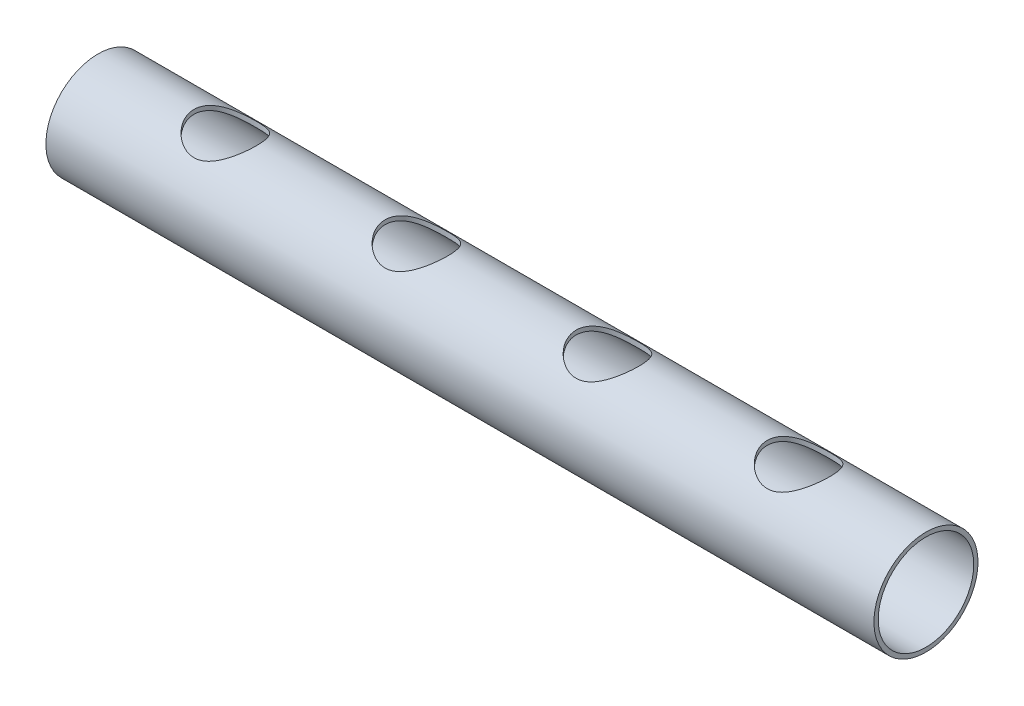
from build123d import *

# Parameters (mm, degrees)
SKETCH1_R           = 41.5
SKETCH1_R_2         = 38.1
BOSS_EXTRUDE1_DEPTH = 660.4
SKETCH2_R           = 25
CUT_EXTRUDE1_DEPTH  = 664.002760175


with BuildPart() as part:
    # Sketch1 → Boss-Extrude1 (new body)
    with BuildSketch(Plane(origin=(0, 0, 0), x_dir=(0, 0, -1), z_dir=(1, 0, 0))):
        Circle(SKETCH1_R)
        Circle(SKETCH1_R_2, mode=Mode.SUBTRACT)
    extrude(amount=BOSS_EXTRUDE1_DEPTH)

    # Sketch2 → Cut-Extrude1 (cut, through all)
    with BuildSketch(Plane(origin=(0, 0, 0), x_dir=(1, 0, 0), z_dir=(0, 1, 0))):
        with Locations(Location((101.6, 0, 0), (0, 0, 90))):
            Circle(SKETCH2_R)
        with Locations(Location((254, 0, 0), (0, 0, 90))):
            Circle(SKETCH2_R)
        with Locations(Location((406.4, 0, 0), (0, 0, 90))):
            Circle(SKETCH2_R)
        with Locations(Location((558.8, 0, 0), (0, 0, 90))):
            Circle(SKETCH2_R)
    extrude(amount=CUT_EXTRUDE1_DEPTH, mode=Mode.SUBTRACT)


solid = part.part
